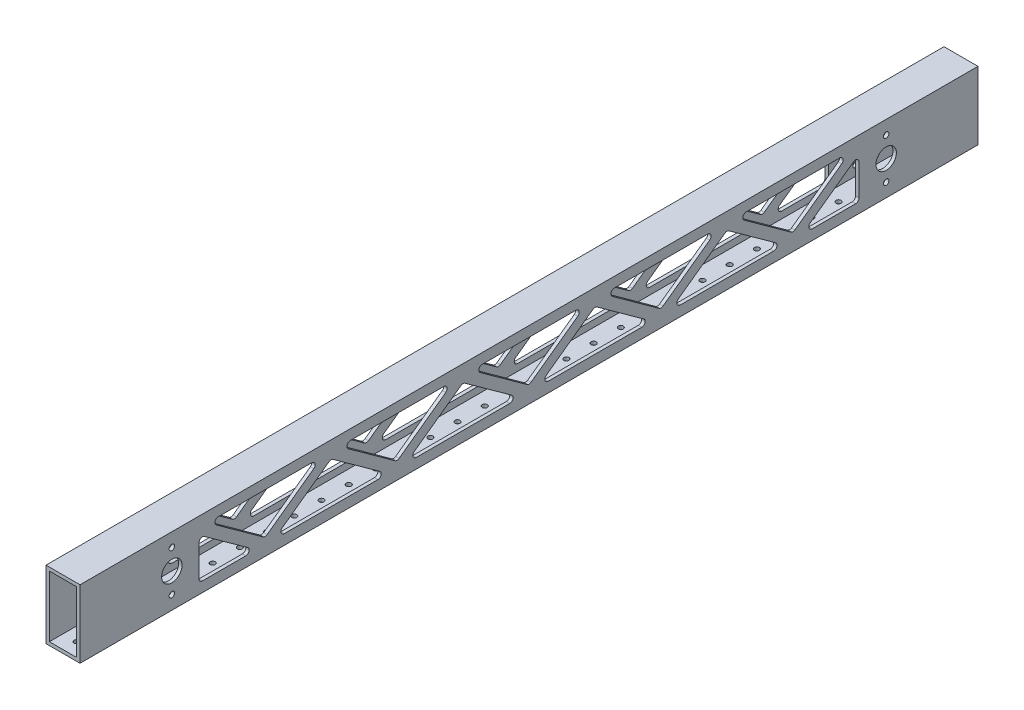
from build123d import *

# Parameters (mm, degrees)
SKETCH1_W           = 31.75
SKETCH1_H           = 63.5
SKETCH1_W_2         = 25.4
SKETCH1_H_2         = 57.15
BOSS_EXTRUDE1_DEPTH = 838.2
CUT_EXTRUDE1_REACH  = 843.015
SKETCH2_R           = 9.525
SKETCH2_R_2         = 2.54
CUT_EXTRUDE2_DEPTH  = 842.015483563
SKETCH4_R           = 2.38125
CUT_EXTRUDE3_DEPTH  = 3.175


with BuildPart() as part:
    # Sketch1 → Boss-Extrude1 (new body)
    with BuildSketch(Plane.XY):
        with Locations((3.710272719, -29.23968021)):
            Rectangle(SKETCH1_W, SKETCH1_H)
        with Locations((3.710272719, -29.23968021)):
            Rectangle(SKETCH1_W_2, SKETCH1_H_2, mode=Mode.SUBTRACT)
    extrude(amount=BOSS_EXTRUDE1_DEPTH)

    # Cut-Extrude1: up to this face of the body (flat: up to its plane)
    cut_extrude1_end = Plane(part.part.faces().sort_by_distance((-12.164727281, -29.23968021, 419.1))[0])
    # Sketch2 → Cut-Extrude1 (cut, up to the picked face)
    with BuildSketch(Plane(origin=(19.585272719, 0, 0), x_dir=(0, 0, -1), z_dir=(1, 0, 0)), mode=Mode.PRIVATE) as cut_extrude1_sk1:
        with Locations(Location((-752.475, -29.23968021, 0), (0, 0, 90))):
            Circle(SKETCH2_R)
    cut_extrude1_tool1 = split(extrude(cut_extrude1_sk1.sketch, amount=-CUT_EXTRUDE1_REACH, mode=Mode.PRIVATE), bisect_by=cut_extrude1_end, keep=Keep.BOTH, mode=Mode.PRIVATE)
    # Sketch2 → Cut-Extrude1 (cut, up to the picked face)
    with BuildSketch(Plane(origin=(19.585272719, 0, 0), x_dir=(0, 0, -1), z_dir=(1, 0, 0)), mode=Mode.PRIVATE) as cut_extrude1_sk2:
        with Locations(Location((-752.475, -48.28968021, 0), (0, 0, 90))):
            Circle(SKETCH2_R_2)
    cut_extrude1_tool2 = split(extrude(cut_extrude1_sk2.sketch, amount=-CUT_EXTRUDE1_REACH, mode=Mode.PRIVATE), bisect_by=cut_extrude1_end, keep=Keep.BOTH, mode=Mode.PRIVATE)
    # Sketch2 → Cut-Extrude1 (cut, up to the picked face)
    with BuildSketch(Plane(origin=(19.585272719, 0, 0), x_dir=(0, 0, -1), z_dir=(1, 0, 0)), mode=Mode.PRIVATE) as cut_extrude1_sk3:
        with Locations(Location((-752.475, -10.18968021, 0), (0, 0, 90))):
            Circle(SKETCH2_R_2)
    cut_extrude1_tool3 = split(extrude(cut_extrude1_sk3.sketch, amount=-CUT_EXTRUDE1_REACH, mode=Mode.PRIVATE), bisect_by=cut_extrude1_end, keep=Keep.BOTH, mode=Mode.PRIVATE)
    # Sketch2 → Cut-Extrude1 (cut, up to the picked face)
    with BuildSketch(Plane(origin=(19.585272719, 0, 0), x_dir=(0, 0, -1), z_dir=(1, 0, 0)), mode=Mode.PRIVATE) as cut_extrude1_sk4:
        with Locations(Location((-85.725, -48.28968021, 0), (0, 0, 270))):
            Circle(SKETCH2_R_2)
    cut_extrude1_tool4 = split(extrude(cut_extrude1_sk4.sketch, amount=-CUT_EXTRUDE1_REACH, mode=Mode.PRIVATE), bisect_by=cut_extrude1_end, keep=Keep.BOTH, mode=Mode.PRIVATE)
    # Sketch2 → Cut-Extrude1 (cut, up to the picked face)
    with BuildSketch(Plane(origin=(19.585272719, 0, 0), x_dir=(0, 0, -1), z_dir=(1, 0, 0)), mode=Mode.PRIVATE) as cut_extrude1_sk5:
        with Locations(Location((-85.725, -29.23968021, 0), (0, 0, 270))):
            Circle(SKETCH2_R)
    cut_extrude1_tool5 = split(extrude(cut_extrude1_sk5.sketch, amount=-CUT_EXTRUDE1_REACH, mode=Mode.PRIVATE), bisect_by=cut_extrude1_end, keep=Keep.BOTH, mode=Mode.PRIVATE)
    # Sketch2 → Cut-Extrude1 (cut, up to the picked face)
    with BuildSketch(Plane(origin=(19.585272719, 0, 0), x_dir=(0, 0, -1), z_dir=(1, 0, 0)), mode=Mode.PRIVATE) as cut_extrude1_sk6:
        with Locations(Location((-85.725, -10.18968021, 0), (0, 0, 270))):
            Circle(SKETCH2_R_2)
    cut_extrude1_tool6 = split(extrude(cut_extrude1_sk6.sketch, amount=-CUT_EXTRUDE1_REACH, mode=Mode.PRIVATE), bisect_by=cut_extrude1_end, keep=Keep.BOTH, mode=Mode.PRIVATE)
    add(cut_extrude1_tool1.solids().sort_by(Axis((19.585273, -29.23968, 752.475), (-1, 0, 0)))[0], mode=Mode.SUBTRACT)
    add(cut_extrude1_tool2.solids().sort_by(Axis((19.585273, -48.28968, 752.475), (-1, 0, 0)))[0], mode=Mode.SUBTRACT)
    add(cut_extrude1_tool3.solids().sort_by(Axis((19.585273, -10.18968, 752.475), (-1, 0, 0)))[0], mode=Mode.SUBTRACT)
    add(cut_extrude1_tool4.solids().sort_by(Axis((19.585273, -48.28968, 85.725), (-1, 0, 0)))[0], mode=Mode.SUBTRACT)
    add(cut_extrude1_tool5.solids().sort_by(Axis((19.585273, -29.23968, 85.725), (-1, 0, 0)))[0], mode=Mode.SUBTRACT)
    add(cut_extrude1_tool6.solids().sort_by(Axis((19.585273, -10.18968, 85.725), (-1, 0, 0)))[0], mode=Mode.SUBTRACT)

    # Sketch3 → Cut-Extrude2 (cut, through all)
    with BuildSketch(Plane(origin=(19.585272719, 0, 0), x_dir=(0, 0, -1), z_dir=(1, 0, 0))):
        with BuildLine():
            Line((-709.111277219, -7.01468021), (-621.848722781, -7.01468021))
            ThreePointArc((-621.848722781, -7.01468021), (-618.827547522, -9.213398974), (-619.990759496, -12.764286477))
            Line((-619.990759496, -12.764286477), (-663.622036715, -44.250775191))
            ThreePointArc((-663.622036715, -44.250775191), (-665.48, -44.851168924), (-667.337963285, -44.250775191))
            Line((-667.337963285, -44.250775191), (-710.969240504, -12.764286477))
            ThreePointArc((-710.969240504, -12.764286477), (-712.132452478, -9.213398974), (-709.111277219, -7.01468021))
        make_face()
        with BuildLine():
            Line((-111.125, -19.094428609), (-111.125, -48.28968021))
            ThreePointArc((-111.125, -48.28968021), (-112.05493597, -50.53474424), (-114.3, -51.46468021))
            Line((-114.3, -51.46468021), (-154.756277219, -51.46468021))
            ThreePointArc((-154.756277219, -51.46468021), (-157.777452478, -49.265961445), (-156.614240504, -45.715073943))
            Line((-156.614240504, -45.715073943), (-116.157963285, -16.519822342))
            ThreePointArc((-116.157963285, -16.519822342), (-112.854041569, -16.267800013), (-111.125, -19.094428609))
        make_face()
        with BuildLine():
            Line((-723.9, -51.46468021), (-683.443722781, -51.46468021))
            ThreePointArc((-683.443722781, -51.46468021), (-680.422547522, -49.265961445), (-681.585759496, -45.715073943))
            Line((-681.585759496, -45.715073943), (-722.042036715, -16.519822342))
            ThreePointArc((-722.042036715, -16.519822342), (-725.345958431, -16.267800013), (-727.075, -19.094428609))
            Line((-727.075, -19.094428609), (-727.075, -48.28968021))
            ThreePointArc((-727.075, -48.28968021), (-726.14506403, -50.53474424), (-723.9, -51.46468021))
        make_face()
        with BuildLine():
            Line((-649.374240504, -45.715073943), (-605.742963285, -14.228585228))
            ThreePointArc((-605.742963285, -14.228585228), (-603.885, -13.628191495), (-602.027036715, -14.228585228))
            Line((-602.027036715, -14.228585228), (-558.395759496, -45.715073943))
            ThreePointArc((-558.395759496, -45.715073943), (-557.232547522, -49.265961445), (-560.253722781, -51.46468021))
            Line((-560.253722781, -51.46468021), (-647.516277219, -51.46468021))
            ThreePointArc((-647.516277219, -51.46468021), (-650.537452478, -49.265961445), (-649.374240504, -45.715073943))
        make_face()
        with BuildLine():
            Line((-526.184240504, -45.715073943), (-482.552963285, -14.228585228))
            ThreePointArc((-482.552963285, -14.228585228), (-480.695, -13.628191495), (-478.837036715, -14.228585228))
            Line((-478.837036715, -14.228585228), (-435.205759496, -45.715073943))
            ThreePointArc((-435.205759496, -45.715073943), (-434.042547522, -49.265961445), (-437.063722781, -51.46468021))
            Line((-437.063722781, -51.46468021), (-524.326277219, -51.46468021))
            ThreePointArc((-524.326277219, -51.46468021), (-527.347452478, -49.265961445), (-526.184240504, -45.715073943))
        make_face()
        with BuildLine():
            Line((-402.994240504, -45.715073943), (-359.362963285, -14.228585228))
            ThreePointArc((-359.362963285, -14.228585228), (-357.505, -13.628191495), (-355.647036715, -14.228585228))
            Line((-355.647036715, -14.228585228), (-312.015759496, -45.715073943))
            ThreePointArc((-312.015759496, -45.715073943), (-310.852547522, -49.265961445), (-313.873722781, -51.46468021))
            Line((-313.873722781, -51.46468021), (-401.136277219, -51.46468021))
            ThreePointArc((-401.136277219, -51.46468021), (-404.157452478, -49.265961445), (-402.994240504, -45.715073943))
        make_face()
        with BuildLine():
            Line((-279.804240504, -45.715073943), (-236.172963285, -14.228585228))
            ThreePointArc((-236.172963285, -14.228585228), (-234.315, -13.628191495), (-232.457036715, -14.228585228))
            Line((-232.457036715, -14.228585228), (-188.825759496, -45.715073943))
            ThreePointArc((-188.825759496, -45.715073943), (-187.662547522, -49.265961445), (-190.683722781, -51.46468021))
            Line((-190.683722781, -51.46468021), (-277.946277219, -51.46468021))
            ThreePointArc((-277.946277219, -51.46468021), (-280.967452478, -49.265961445), (-279.804240504, -45.715073943))
        make_face()
        with BuildLine():
            Line((-587.779240504, -12.764286477), (-544.147963285, -44.250775191))
            ThreePointArc((-544.147963285, -44.250775191), (-542.29, -44.851168924), (-540.432036715, -44.250775191))
            Line((-540.432036715, -44.250775191), (-496.800759496, -12.764286477))
            ThreePointArc((-496.800759496, -12.764286477), (-495.637547522, -9.213398974), (-498.658722781, -7.01468021))
            Line((-498.658722781, -7.01468021), (-585.921277219, -7.01468021))
            ThreePointArc((-585.921277219, -7.01468021), (-588.942452478, -9.213398974), (-587.779240504, -12.764286477))
        make_face()
        with BuildLine():
            Line((-464.589240504, -12.764286477), (-420.957963285, -44.250775191))
            ThreePointArc((-420.957963285, -44.250775191), (-419.1, -44.851168924), (-417.242036715, -44.250775191))
            Line((-417.242036715, -44.250775191), (-373.610759496, -12.764286477))
            ThreePointArc((-373.610759496, -12.764286477), (-372.447547522, -9.213398974), (-375.468722781, -7.01468021))
            Line((-375.468722781, -7.01468021), (-462.731277219, -7.01468021))
            ThreePointArc((-462.731277219, -7.01468021), (-465.752452478, -9.213398974), (-464.589240504, -12.764286477))
        make_face()
        with BuildLine():
            Line((-341.399240504, -12.764286477), (-297.767963285, -44.250775191))
            ThreePointArc((-297.767963285, -44.250775191), (-295.91, -44.851168924), (-294.052036715, -44.250775191))
            Line((-294.052036715, -44.250775191), (-250.420759496, -12.764286477))
            ThreePointArc((-250.420759496, -12.764286477), (-249.257547522, -9.213398974), (-252.278722781, -7.01468021))
            Line((-252.278722781, -7.01468021), (-339.541277219, -7.01468021))
            ThreePointArc((-339.541277219, -7.01468021), (-342.562452478, -9.213398974), (-341.399240504, -12.764286477))
        make_face()
        with BuildLine():
            Line((-218.209240504, -12.764286477), (-174.577963285, -44.250775191))
            ThreePointArc((-174.577963285, -44.250775191), (-172.72, -44.851168924), (-170.862036715, -44.250775191))
            Line((-170.862036715, -44.250775191), (-127.230759496, -12.764286477))
            ThreePointArc((-127.230759496, -12.764286477), (-126.067547522, -9.213398974), (-129.088722781, -7.01468021))
            Line((-129.088722781, -7.01468021), (-216.351277219, -7.01468021))
            ThreePointArc((-216.351277219, -7.01468021), (-219.372452478, -9.213398974), (-218.209240504, -12.764286477))
        make_face()
    extrude(amount=-CUT_EXTRUDE2_DEPTH, mode=Mode.SUBTRACT)

    # Sketch4 → Cut-Extrude3 (cut)
    with BuildSketch(Plane.XZ.offset(60.98968021)):
        with Locations(Location((3.710272719, 825.5, 0), (0, 0, 270))):
            Circle(SKETCH4_R)
        with Locations(Location((3.710272719, 800.1, 0), (0, 0, 270))):
            Circle(SKETCH4_R)
        with Locations(Location((3.710272719, 774.7, 0), (0, 0, 270))):
            Circle(SKETCH4_R)
        with Locations(Location((3.710272719, 749.3, 0), (0, 0, 270))):
            Circle(SKETCH4_R)
        with Locations(Location((3.710272719, 723.9, 0), (0, 0, 270))):
            Circle(SKETCH4_R)
        with Locations(Location((3.710272719, 698.5, 0), (0, 0, 270))):
            Circle(SKETCH4_R)
        with Locations(Location((3.710272719, 673.1, 0), (0, 0, 270))):
            Circle(SKETCH4_R)
        with Locations(Location((3.710272719, 647.7, 0), (0, 0, 270))):
            Circle(SKETCH4_R)
        with Locations(Location((3.710272719, 622.3, 0), (0, 0, 270))):
            Circle(SKETCH4_R)
        with Locations(Location((3.710272719, 596.9, 0), (0, 0, 270))):
            Circle(SKETCH4_R)
        with Locations(Location((3.710272719, 571.5, 0), (0, 0, 270))):
            Circle(SKETCH4_R)
        with Locations(Location((3.710272719, 546.1, 0), (0, 0, 270))):
            Circle(SKETCH4_R)
        with Locations(Location((3.710272719, 520.7, 0), (0, 0, 270))):
            Circle(SKETCH4_R)
        with Locations(Location((3.710272719, 495.3, 0), (0, 0, 270))):
            Circle(SKETCH4_R)
        with Locations(Location((3.710272719, 469.9, 0), (0, 0, 270))):
            Circle(SKETCH4_R)
        with Locations(Location((3.710272719, 444.5, 0), (0, 0, 270))):
            Circle(SKETCH4_R)
        with Locations(Location((3.710272719, 419.1, 0), (0, 0, 270))):
            Circle(SKETCH4_R)
        with Locations(Location((3.710272719, 393.7, 0), (0, 0, 270))):
            Circle(SKETCH4_R)
        with Locations(Location((3.710272719, 368.3, 0), (0, 0, 270))):
            Circle(SKETCH4_R)
        with Locations(Location((3.710272719, 342.9, 0), (0, 0, 270))):
            Circle(SKETCH4_R)
        with Locations(Location((3.710272719, 317.5, 0), (0, 0, 270))):
            Circle(SKETCH4_R)
        with Locations(Location((3.710272719, 292.1, 0), (0, 0, 270))):
            Circle(SKETCH4_R)
        with Locations(Location((3.710272719, 266.7, 0), (0, 0, 270))):
            Circle(SKETCH4_R)
        with Locations(Location((3.710272719, 241.3, 0), (0, 0, 270))):
            Circle(SKETCH4_R)
        with Locations(Location((3.710272719, 215.9, 0), (0, 0, 270))):
            Circle(SKETCH4_R)
        with Locations(Location((3.710272719, 190.5, 0), (0, 0, 270))):
            Circle(SKETCH4_R)
        with Locations(Location((3.710272719, 165.1, 0), (0, 0, 270))):
            Circle(SKETCH4_R)
        with Locations(Location((3.710272719, 139.7, 0), (0, 0, 270))):
            Circle(SKETCH4_R)
        with Locations(Location((3.710272719, 114.3, 0), (0, 0, 270))):
            Circle(SKETCH4_R)
        with Locations(Location((3.710272719, 88.9, 0), (0, 0, 270))):
            Circle(SKETCH4_R)
        with Locations(Location((3.710272719, 63.5, 0), (0, 0, 270))):
            Circle(SKETCH4_R)
        with Locations(Location((3.710272719, 38.1, 0), (0, 0, 270))):
            Circle(SKETCH4_R)
        with Locations(Location((3.710272719, 12.7, 0), (0, 0, 270))):
            Circle(SKETCH4_R)
    extrude(amount=-CUT_EXTRUDE3_DEPTH, mode=Mode.SUBTRACT)


solid = part.part
